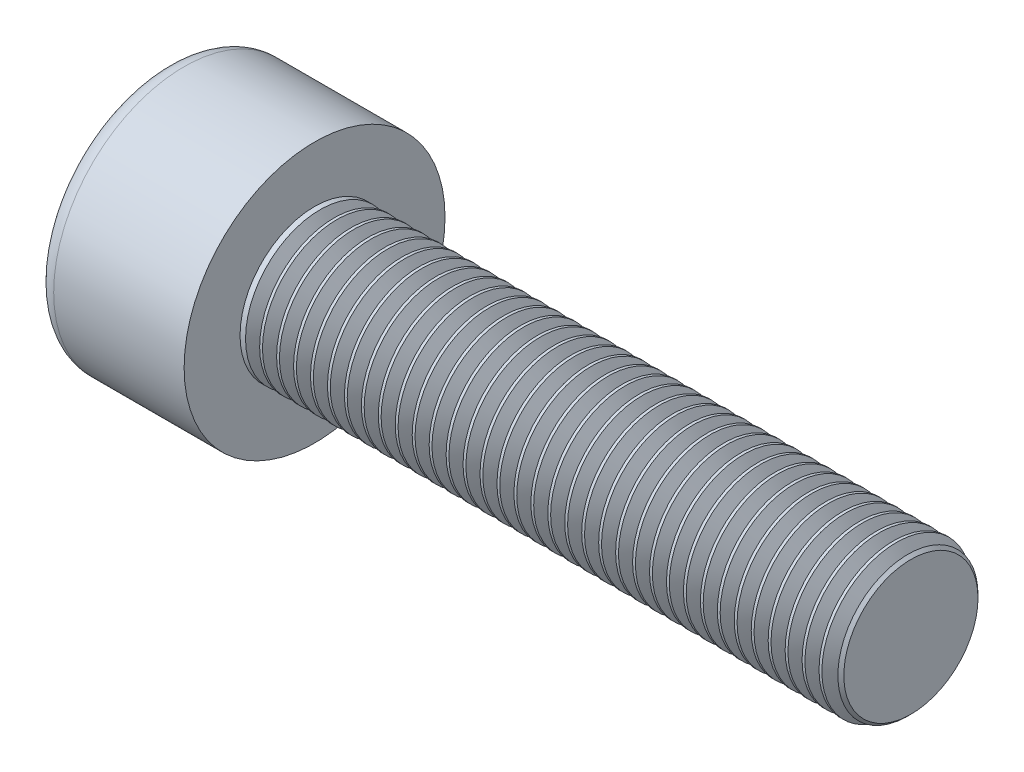
from build123d import *

# Parameters (mm, degrees)
SKETCH1_R           = 3.5
BASEHEAD_DEPTH      = 4
SKETCH2_R           = 2
BASEBODY_DEPTH      = 16
HEXAGONSOCKET_DEPTH = 2
TOPFILLET_R         = 0.5
CHAMFER1_SIZE       = 0.2
LPATTERN10_COUNT    = 35
LPATTERN10_PITCH    = 0.4548


with BuildPart() as part:
    # Sketch1 → BaseHead (new body)
    with BuildSketch(Plane(origin=(0, 0, 0), x_dir=(0, 0, -1), z_dir=(1, 0, 0))):
        Circle(SKETCH1_R)
    extrude(amount=BASEHEAD_DEPTH)

    # Sketch2 → BaseBody (add)
    with BuildSketch(Plane(origin=(4, 0, 0), x_dir=(0, 0, -1), z_dir=(1, 0, 0))):
        Circle(SKETCH2_R)
    extrude(amount=BASEBODY_DEPTH)

    # Sketch3 → HexagonSocket (cut)
    with BuildSketch(Plane(origin=(0, 0, 0), x_dir=(0, 0, -1), z_dir=(1, 0, 0))):
        Polygon((1.732050808, 0), (0.866025404, 1.5), (-0.866025404, 1.5), (-1.732050808, 0), (-0.866025404, -1.5), (0.866025404, -1.5), align=None)
    extrude(amount=HEXAGONSOCKET_DEPTH, mode=Mode.SUBTRACT)

    # Sketch4 → Cut-Revolve1 (revolve, cut)
    with BuildSketch(Plane(origin=(-4.19613823, 0.75, 0), x_dir=(-1, 0, 0), z_dir=(0, 0, 1)), mode=Mode.PRIVATE) as cut_revolve1_sk:
        Polygon((-6.19613823, 2.25), (-7.062163633, 0.75), (-6.19613823, 0.75), align=None)
    revolve(cut_revolve1_sk.sketch.rotate(Axis((0.838992387, 0, 0), (-1, 0, 0)), 90), axis=Axis((0.838992387, 0, 0), (-1, 0, 0)), mode=Mode.SUBTRACT)

    # TopFillet
    topfillet_edges = [part.edges().sort_by_distance(p)[0] for p in [
        (0, 0, 3.5),
    ]]
    fillet(topfillet_edges, radius=TOPFILLET_R)

    # Chamfer1
    chamfer1_edges = [part.edges().sort_by_distance(p)[0] for p in [
        (20, 0, 2),
    ]]
    chamfer(chamfer1_edges, length=CHAMFER1_SIZE)

    # Sketch5 → Cut-Revolve10 (revolve, cut)
    with BuildSketch(Plane.XY, mode=Mode.PRIVATE) as cut_revolve10_sk:
        Polygon((19.8, 1.671776372), (19.9895, 2), (19.9895, 2.379), (19.6105, 2.379), (19.6105, 2), align=None)
    cut_revolve10 = revolve(cut_revolve10_sk.sketch.rotate(Axis((0, 0, 0), (1, 0, 0)), 90), axis=Axis((0, 0, 0), (1, 0, 0)), mode=Mode.SUBTRACT)

    # LPattern10: Cut-Revolve10 ×35
    with Locations(*[(-i * LPATTERN10_PITCH, 0, 0) for i in range(1, LPATTERN10_COUNT)]):
        add(cut_revolve10, mode=Mode.SUBTRACT)


solid = part.part
